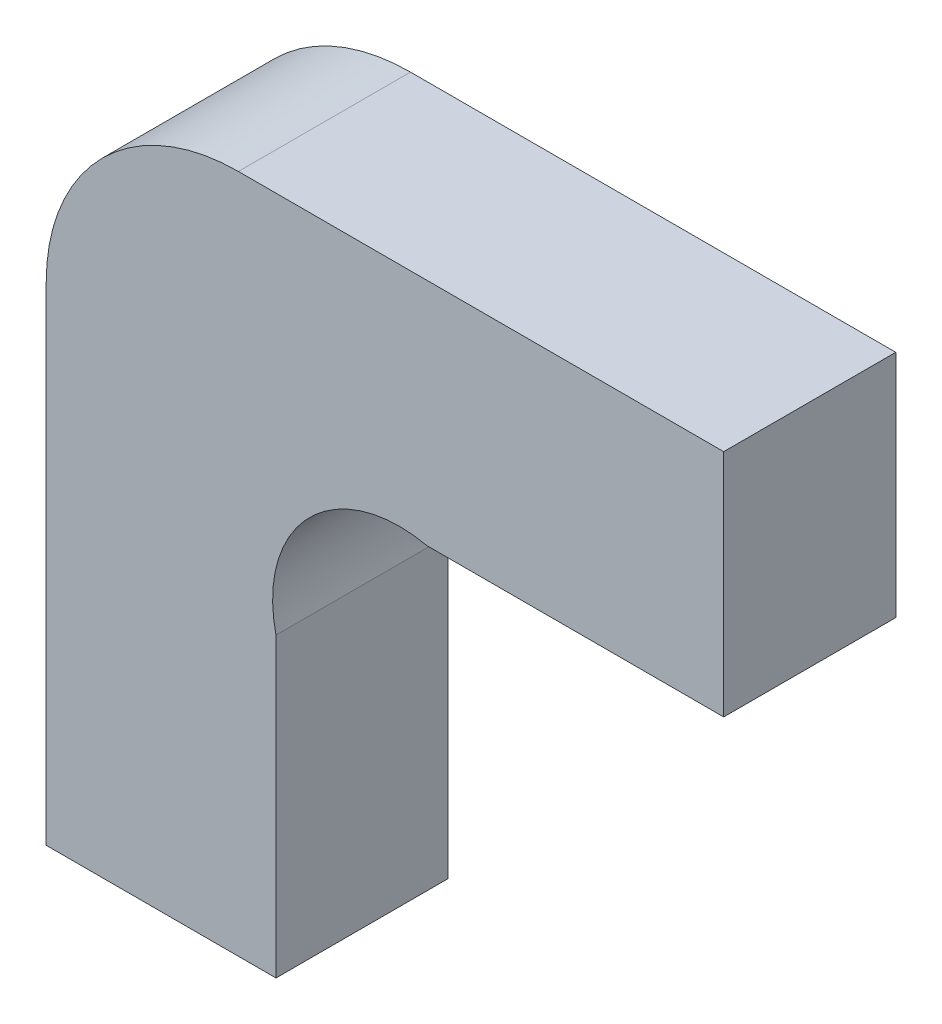
from build123d import *

# Parameters (mm, degrees)
BOSS_EXTRUDE1_DEPTH = 43.942


with BuildPart() as part:
    # Sketch1 → Boss-Extrude1 (new body)
    with BuildSketch(Plane.XY):
        with BuildLine():
            Line((-97.195150035, 54.413973123), (-97.195150035, -70.065714516))
            Line((-97.195150035, -70.065714516), (-38.521150035, -70.065714516))
            Line((-38.521150035, -70.065714516), (-38.521150035, 5.773662932))
            ThreePointArc((-38.521150035, 5.773662932), (-30.060459772, 35.949604475), (0, 44.811855093))
            Line((0, 44.811855093), (75.792299163, 44.811855093))
            Line((75.792299163, 44.811855093), (75.792299163, 103.485855093))
            Line((75.792299163, 103.485855093), (-48.123268066, 103.485855093))
            ThreePointArc((-48.123268066, 103.485855093), (-82.822328572, 89.11303363), (-97.195150035, 54.413973123))
        make_face()
    extrude(amount=BOSS_EXTRUDE1_DEPTH)


solid = part.part
